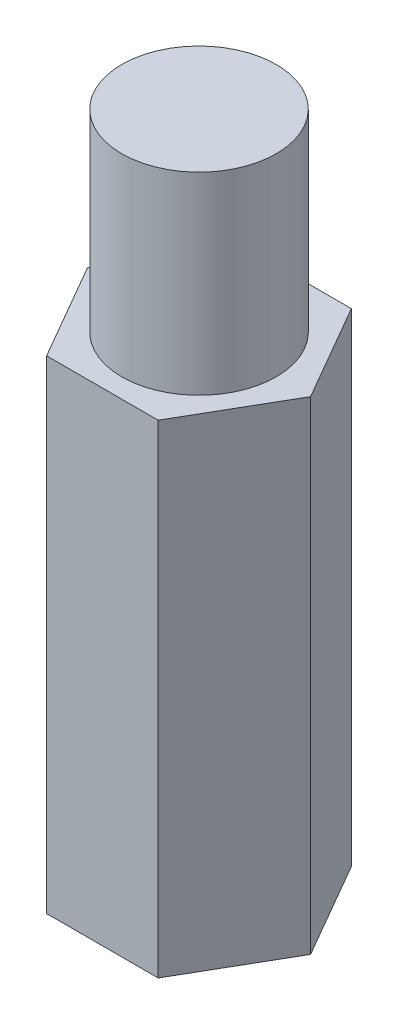
from build123d import *

# Parameters (mm, degrees)
EXTRUDE_1_DEPTH     = 10
SKETCH_2_R          = 1.6
EXTRUDE_2_DEPTH     = 4
SKETCH_3_R          = 1.6
CUT_EXTRUDE_1_DEPTH = 4


with BuildPart() as part:
    # 草图1 → 凸台-拉伸1 (new body)
    with BuildSketch(Plane(origin=(0, 0, 0), x_dir=(1, 0, 0), z_dir=(0, 1, 0))):
        Polygon((2.309401077, 0), (1.154700538, 2), (-1.154700538, 2), (-2.309401077, 0), (-1.154700538, -2), (1.154700538, -2), align=None)
    extrude(amount=EXTRUDE_1_DEPTH)

    # 草图2 → 凸台-拉伸2 (add)
    with BuildSketch(Plane(origin=(0, 10, 0), x_dir=(1, 0, 0), z_dir=(0, 1, 0))):
        with Locations(Location((0, 0, 0), (0, 0, 270))):
            Circle(SKETCH_2_R)
    extrude(amount=EXTRUDE_2_DEPTH)

    # 草图3 → 切除-拉伸1 (cut)
    with BuildSketch(Plane.XZ):
        with Locations(Location((0, 0, 0), (0, 0, 90))):
            Circle(SKETCH_3_R)
    extrude(amount=-CUT_EXTRUDE_1_DEPTH, mode=Mode.SUBTRACT)


solid = part.part
